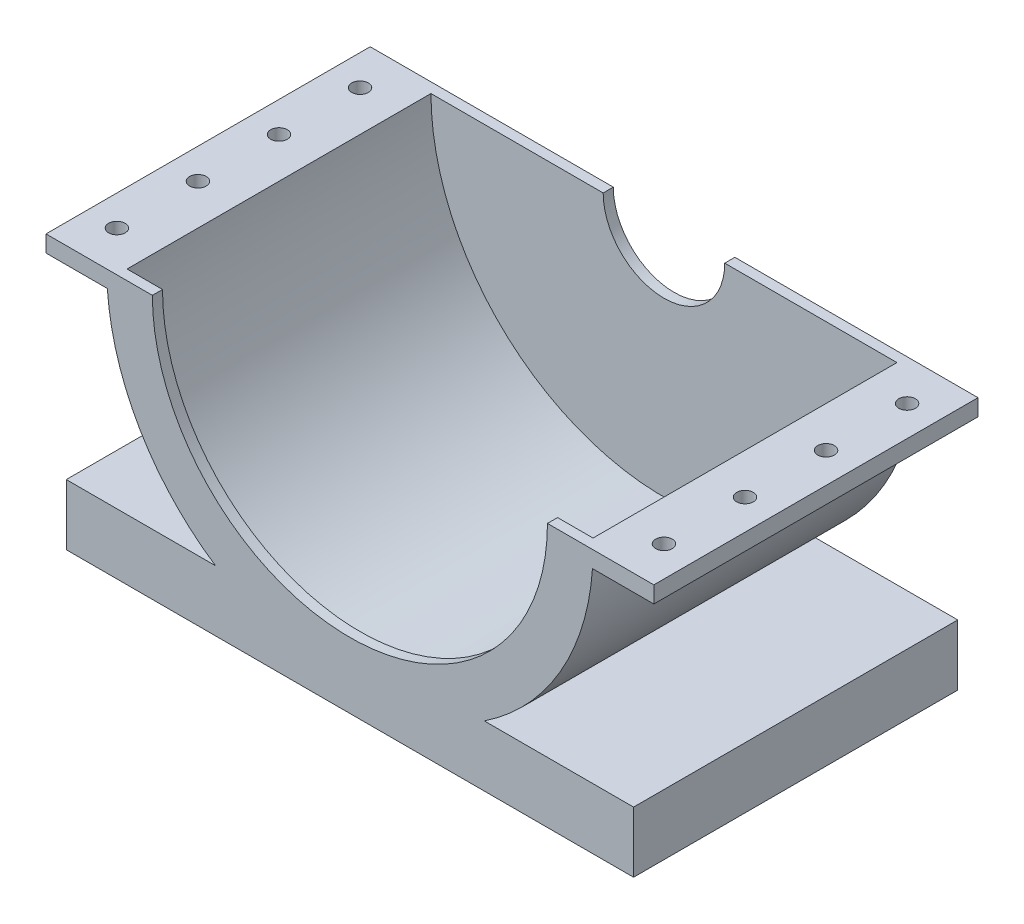
from build123d import *

# Parameters (mm, degrees)
BOSS_EXTRUDE1_DEPTH = 101.6
CUT_EXTRUDE1_DEPTH  = 95.25
CUT_EXTRUDE2_REACH  = 316.501
SKETCH5_R           = 123.825
SKETCH6_R           = 38.1
CUT_EXTRUDE3_DEPTH  = 311.436426664
SKETCH7_R           = 5.207
CUT_EXTRUDE4_DEPTH  = 83.566


with BuildPart() as part:
    # Sketch2 → Boss-Extrude1 (new, symmetric)
    with BuildSketch(Plane.XY):
        with BuildLine():
            Line((-190.5, 135.636), (-152.043772, 135.636))
            ThreePointArc((-152.043772, 135.636), (0, -6.35), (152.043772, 135.636))
            Line((152.043772, 135.636), (190.5, 135.636))
            Line((190.5, 135.636), (190.5, 146.05))
            Line((190.5, 146.05), (152.4, 146.05))
            Line((152.4, 146.05), (-152.4, 146.05))
            Line((-152.4, 146.05), (-190.5, 146.05))
            Line((-190.5, 146.05), (-190.5, 135.636))
        make_face()
        with BuildLine():
            Line((-84.242269675, 19.05), (-177.8, 19.05))
            Line((-177.8, 19.05), (-177.8, -19.05))
            Line((-177.8, -19.05), (177.8, -19.05))
            Line((177.8, -19.05), (177.8, 19.05))
            Line((177.8, 19.05), (84.242269675, 19.05))
            ThreePointArc((84.242269675, 19.05), (0, -6.35), (-84.242269675, 19.05))
        make_face()
    extrude(amount=BOSS_EXTRUDE1_DEPTH, both=True)

    # Sketch4 → Cut-Extrude1 (cut, symmetric)
    with BuildSketch(Plane.XY):
        with BuildLine():
            Line((-146.05, 146.05), (146.05, 146.05))
            ThreePointArc((146.05, 146.05), (0, 0), (-146.05, 146.05))
        make_face()
    extrude(amount=CUT_EXTRUDE1_DEPTH, both=True, mode=Mode.SUBTRACT)

    # Sketch5 → Cut-Extrude2 (cut, up to next)
    with BuildSketch(Plane.XY.offset(101.6), mode=Mode.PRIVATE) as cut_extrude2_sk1:
        with Locations((0, 146.05)):
            Circle(SKETCH5_R)
    cut_extrude2_tool1 = extrude(cut_extrude2_sk1.sketch, amount=-CUT_EXTRUDE2_REACH, mode=Mode.PRIVATE) & part.part
    add(cut_extrude2_tool1.solids().sort_by_distance((0, 146.05, 101.6))[0], mode=Mode.SUBTRACT)

    # Sketch6 → Cut-Extrude3 (cut, through all)
    with BuildSketch(Plane.XY.offset(-95.25)):
        with Locations((0, 146.05)):
            Circle(SKETCH6_R)
    extrude(amount=-CUT_EXTRUDE3_DEPTH, mode=Mode.SUBTRACT)

    # Sketch7 → Cut-Extrude4 (cut)
    with BuildSketch(Plane(origin=(0, 146.05, 0), x_dir=(1, 0, 0), z_dir=(0, 1, 0))):
        with Locations(Location((-171.45, 76.2, 0), (0, 0, 270))):
            Circle(SKETCH7_R)
        with Locations(Location((-171.45, 25.4, 0), (0, 0, 270))):
            Circle(SKETCH7_R)
        with Locations(Location((-171.45, -25.4, 0), (0, 0, 270))):
            Circle(SKETCH7_R)
        with Locations(Location((-171.45, -76.2, 0), (0, 0, 270))):
            Circle(SKETCH7_R)
        with Locations((171.45, -76.2)):
            Circle(SKETCH7_R)
        with Locations((171.45, -25.4)):
            Circle(SKETCH7_R)
        with Locations((171.45, 25.4)):
            Circle(SKETCH7_R)
        with Locations((171.45, 76.2)):
            Circle(SKETCH7_R)
    extrude(amount=-CUT_EXTRUDE4_DEPTH, mode=Mode.SUBTRACT)


solid = part.part
